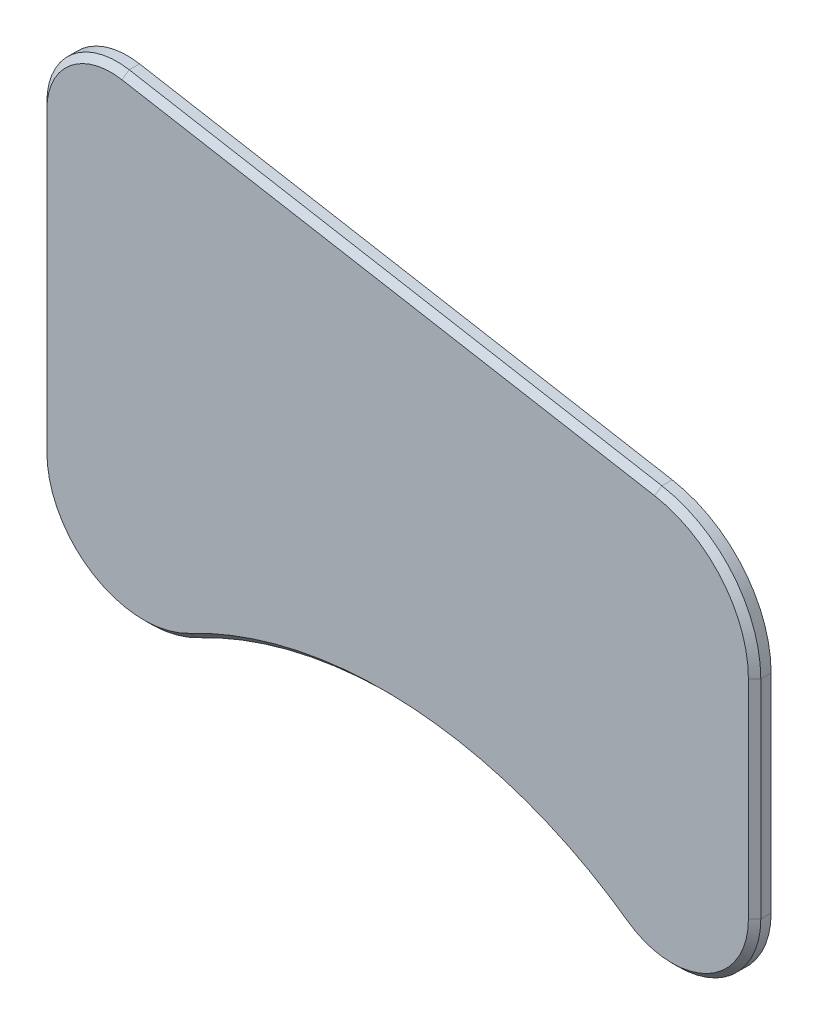
from build123d import *

# Parameters (mm, degrees)
BOSS_EXTRUDE1_DEPTH = 4
CHAMFER1_SIZE       = 1.5


with BuildPart() as part:
    # Sketch1 → Boss-Extrude1 (new body)
    with BuildSketch(Plane.XY):
        with BuildLine():
            Line((-70.04798098, 42.798720736), (59.035797152, 20.037767879))
            ThreePointArc((59.035797152, 20.037767879), (76.21528885, 10.119183723), (83, -8.521656958))
            Line((83, -8.521656958), (83, -58.921656958))
            ThreePointArc((83, -58.921656958), (72.147912935, -76.706923022), (51.368431106, -75.191463505))
            ThreePointArc((51.368431106, -75.191463505), (0.018293401, -56.7724897), (-53.357882673, -68.045424814))
            ThreePointArc((-53.357882673, -68.045424814), (-77.92182392, -67.32320986), (-90, -45.921656958))
            Line((-90, -45.921656958), (-90, 26.056988934))
            ThreePointArc((-90, 26.056988934), (-83.927389365, 39.079744467), (-70.04798098, 42.798720736))
        make_face()
    extrude(amount=BOSS_EXTRUDE1_DEPTH)

    # Chamfer1
    chamfer1_edges = [part.edges().sort_by_distance(p)[0] for p in [
        (-77.92182392, -67.32320986, 4),
        (0.018293401, -56.7724897, 4),
        (72.147912935, -76.706923022, 4),
        (83, -33.721656958, 4),
        (76.21528885, 10.119183723, 4),
        (-5.506091914, 31.418244307, 4),
        (-83.927389365, 39.079744467, 4),
        (-90, -9.932334012, 4),
    ]]
    chamfer(chamfer1_edges, length=CHAMFER1_SIZE)


solid = part.part
